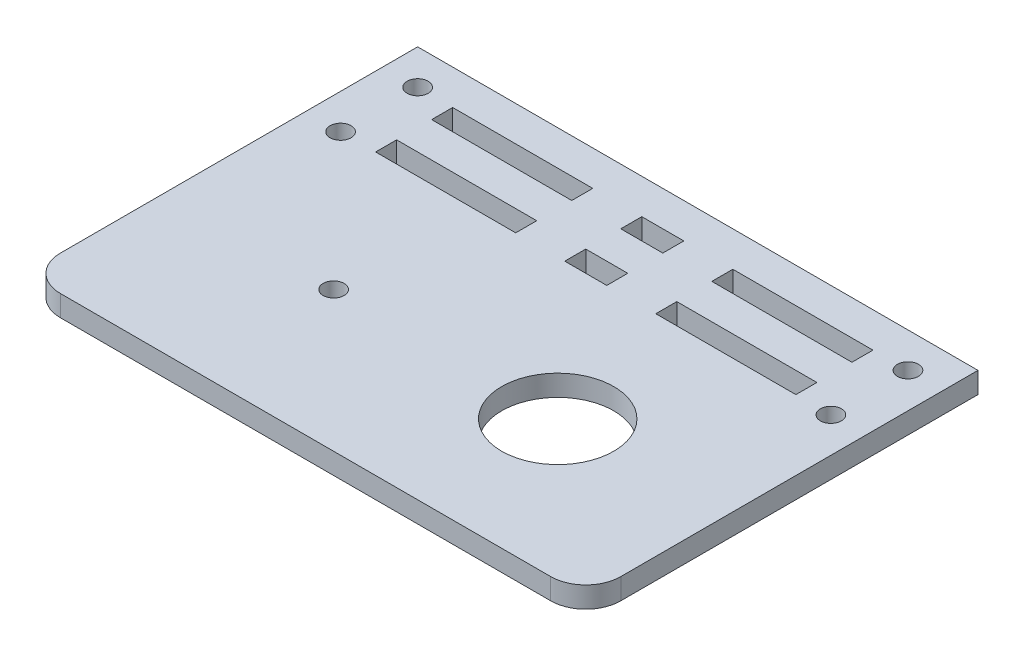
from build123d import *

# Parameters (mm, degrees)
SKETCH_1_R      = 8
SKETCH_1_R_2    = 1.5
SKETCH_1_W      = 20
SKETCH_1_H      = 3
SKETCH_1_W_2    = 6
EXTRUDE_1_DEPTH = 3


with BuildPart() as part:
    # 草图1 → 凸台-拉伸1 (new body)
    with BuildSketch(Plane(origin=(0, 0, 0), x_dir=(1, 0, 0), z_dir=(0, 1, 0))):
        with BuildLine():
            Line((-40, 0), (-40, 20))
            Line((-40, 20), (-40, 36))
            Line((-40, 36), (40, 36))
            Line((40, 36), (40, 20))
            Line((40, 20), (40, -15))
            ThreePointArc((40, -15), (38.535533906, -18.535533906), (35, -20))
            Line((35, -20), (0, -20))
            Line((0, -20), (-35, -20))
            ThreePointArc((-35, -20), (-38.535533906, -18.535533906), (-40, -15))
            Line((-40, -15), (-40, 0))
        make_face()
        with Locations(Location((16, 0, 0), (0, 0, 270))):
            Circle(SKETCH_1_R, mode=Mode.SUBTRACT)
        with Locations(Location((-16, 0, 0), (0, 0, 270))):
            Circle(SKETCH_1_R_2, mode=Mode.SUBTRACT)
        with Locations(Location((-35, 31, 0), (0, 0, 270))):
            Circle(SKETCH_1_R_2, mode=Mode.SUBTRACT)
        with Locations(Location((-35, 20, 0), (0, 0, 270))):
            Circle(SKETCH_1_R_2, mode=Mode.SUBTRACT)
        with Locations(Location((35, 20, 0), (0, 0, 270))):
            Circle(SKETCH_1_R_2, mode=Mode.SUBTRACT)
        with Locations(Location((35, 31, 0), (0, 0, 270))):
            Circle(SKETCH_1_R_2, mode=Mode.SUBTRACT)
        Polygon((-30, 20), (-10, 20), (-10, 23), (-20, 23), (-30, 23), align=None, mode=Mode.SUBTRACT)
        Polygon((10, 23), (10, 20), (30, 20), (30, 23), (20, 23), align=None, mode=Mode.SUBTRACT)
        with Locations((20, 29.5)):
            Rectangle(SKETCH_1_W, SKETCH_1_H, mode=Mode.SUBTRACT)
        with Locations((0, 29.5)):
            Rectangle(SKETCH_1_W_2, SKETCH_1_H, mode=Mode.SUBTRACT)
        with Locations((-20, 29.5)):
            Rectangle(SKETCH_1_W, SKETCH_1_H, mode=Mode.SUBTRACT)
        with Locations((0, 21.5)):
            Rectangle(SKETCH_1_W_2, SKETCH_1_H, mode=Mode.SUBTRACT)
    extrude(amount=EXTRUDE_1_DEPTH)


solid = part.part
